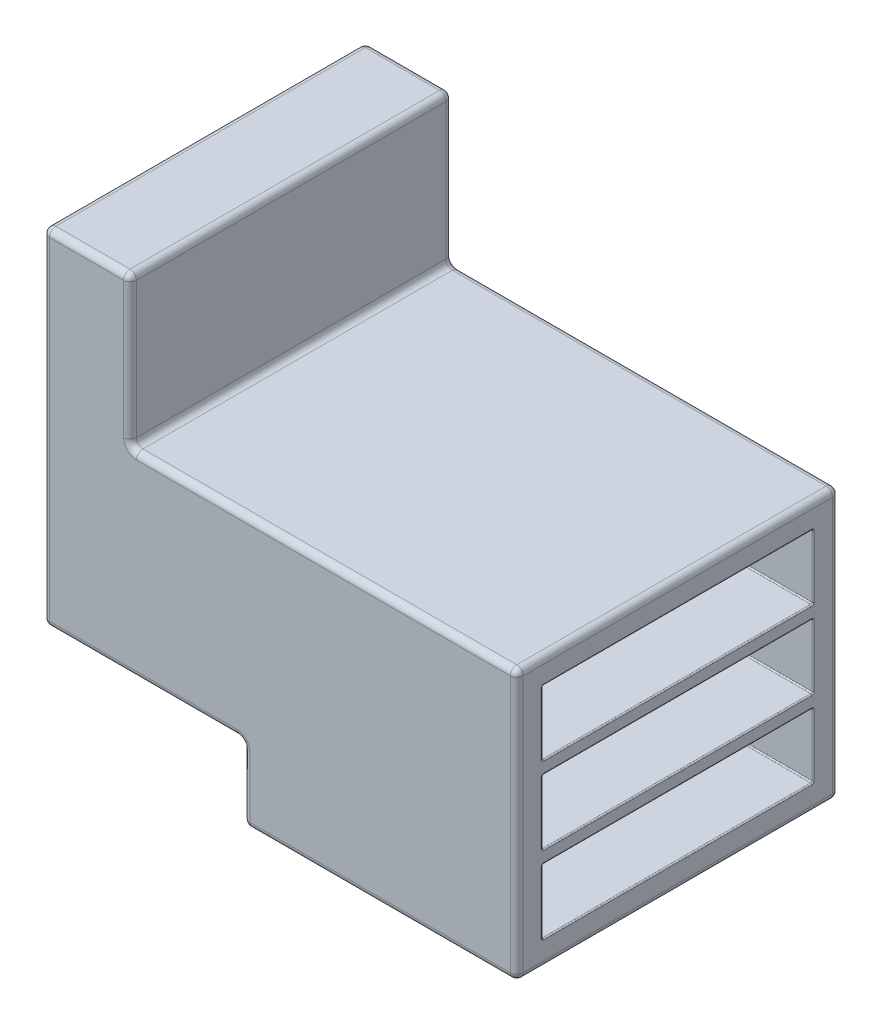
from build123d import *

# Parameters (mm, degrees)
SKETCH1_W           = 735
SKETCH1_H           = 500
BOSS_EXTRUDE1_DEPTH = 418.8
SKETCH6_W           = 500
SKETCH6_H           = 231.6
BOSS_EXTRUDE2_DEPTH = 135
SKETCH2_W           = 311
SKETCH2_H           = 115
CUT_EXTRUDE1_DEPTH  = 500
FILLET1_R           = 10
SKETCH4_W           = 420
SKETCH4_H           = 100
CUT_EXTRUDE2_DEPTH  = 170
SKETCH5_W           = 420
SKETCH5_H           = 100
CUT_EXTRUDE3_DEPTH  = 470
FILLET2_R           = 2


with BuildPart() as part:
    # Sketch1 → Boss-Extrude1 (new body)
    with BuildSketch(Plane(origin=(0, 0, 0), x_dir=(1, 0, 0), z_dir=(0, 1, 0))):
        with Locations((367.5, 250)):
            Rectangle(SKETCH1_W, SKETCH1_H)
    extrude(amount=BOSS_EXTRUDE1_DEPTH)

    # Sketch6 → Boss-Extrude2 (add)
    with BuildSketch(Plane.ZY):
        with Locations((-250, 534.6)):
            Rectangle(SKETCH6_W, SKETCH6_H)
    extrude(amount=-BOSS_EXTRUDE2_DEPTH)

    # Sketch2 → Cut-Extrude1 (cut)
    with BuildSketch(Plane.XY):
        with Locations((155.5, 57.5)):
            Rectangle(SKETCH2_W, SKETCH2_H)
    extrude(amount=-CUT_EXTRUDE1_DEPTH, mode=Mode.SUBTRACT)

    # Fillet1
    fillet1_edges = [part.edges().sort_by_distance(p)[0] for p in [
        (735, 418.8, -250),
        (435, 418.8, 0),
        (135, 534.6, 0),
        (67.5, 650.4, 0),
        (135, 418.8, -250),
        (135, 534.6, -500),
        (135, 650.4, -250),
        (67.5, 650.4, -500),
        (435, 418.8, -500),
        (0, 650.4, -250),
        (523, 0, 0),
        (0, 115, -250),
        (311, 115, -250),
        (311, 0, -250),
        (311, 57.5, 0),
        (155.5, 115, 0),
        (155.5, 115, -500),
        (311, 57.5, -500),
        (523, 0, -500),
        (735, 0, -250),
        (0, 382.7, -500),
        (735, 209.4, -500),
        (735, 209.4, 0),
        (0, 382.7, 0),
    ]]
    fillet(fillet1_edges, radius=FILLET1_R)

    # Sketch4 → Cut-Extrude2 (cut)
    with BuildSketch(Plane(origin=(735, 0, 0), x_dir=(0, 0, -1), z_dir=(1, 0, 0))):
        with Locations((250, 90)):
            Rectangle(SKETCH4_W, SKETCH4_H)
    extrude(amount=-CUT_EXTRUDE2_DEPTH, mode=Mode.SUBTRACT)

    # Sketch5 → Cut-Extrude3 (cut)
    with BuildSketch(Plane(origin=(735, 0, 0), x_dir=(0, 0, -1), z_dir=(1, 0, 0))):
        with Locations((250, 210)):
            Rectangle(SKETCH5_W, SKETCH5_H)
        with Locations((250, 330)):
            Rectangle(SKETCH5_W, SKETCH5_H)
    extrude(amount=-CUT_EXTRUDE3_DEPTH, mode=Mode.SUBTRACT)

    # Fillet2
    fillet2_edges = [part.edges().sort_by_distance(p)[0] for p in [
        (565, 90, -40),
        (650, 40, -40),
        (565, 140, -250),
        (650, 140, -40),
        (565, 90, -460),
        (650, 140, -460),
        (565, 40, -250),
        (650, 40, -460),
        (735, 90, -40),
        (735, 40, -250),
        (735, 90, -460),
        (735, 140, -250),
        (265, 210, -40),
        (500, 160, -40),
        (265, 260, -250),
        (500, 260, -40),
        (265, 210, -460),
        (500, 260, -460),
        (265, 160, -250),
        (500, 160, -460),
        (735, 210, -40),
        (735, 160, -250),
        (735, 210, -460),
        (735, 260, -250),
        (265, 330, -40),
        (500, 280, -40),
        (265, 380, -250),
        (500, 380, -40),
        (265, 330, -460),
        (500, 380, -460),
        (265, 280, -250),
        (500, 280, -460),
        (735, 330, -40),
        (735, 280, -250),
        (735, 330, -460),
        (735, 380, -250),
    ]]
    fillet(fillet2_edges, radius=FILLET2_R)


solid = part.part
